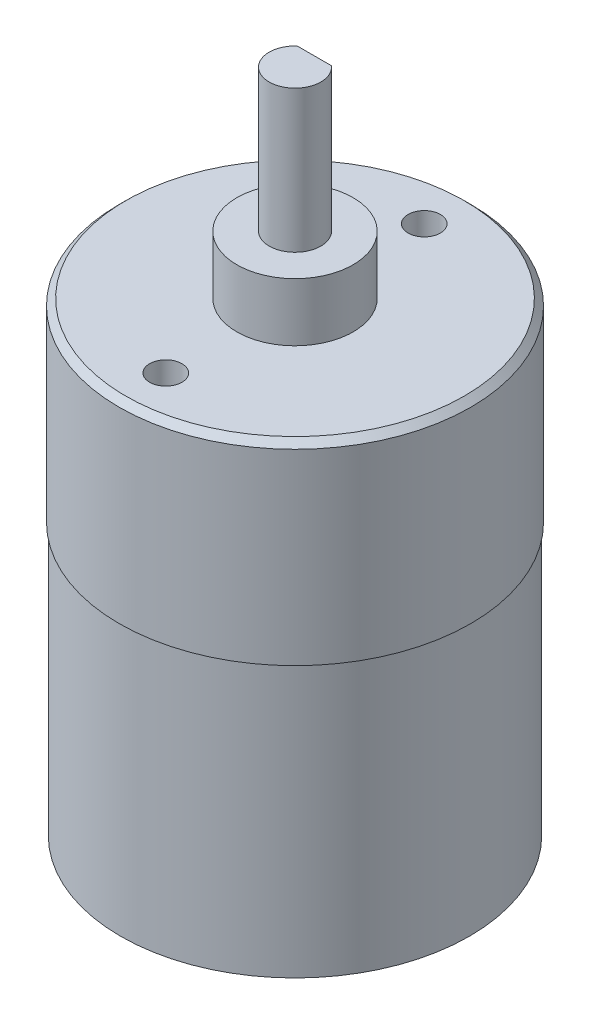
from build123d import *

# Parameters (mm, degrees)
ENL_V_MAT_EXTRU_1_DEPTH = 8.5
ESQUISSE3_R             = 1.25
ENL_V_MAT_EXTRU_2_DEPTH = 4
CHANFREIN1_SIZE         = 0.5


with BuildPart() as part:
    # Esquisse1 → Révolution1 (revolve)
    with BuildSketch(Plane.XY, mode=Mode.PRIVATE) as r_volution1_sk:
        Polygon((4.25, 1), (13.5, 1), (13.5, 22), (13.6, 22), (13.6, 37), (4.5, 37), (4.5, 41.5), (2, 41.5), (2, 52.5), (0, 52.5), (0, 0), (4.25, 0), align=None)
    revolve(r_volution1_sk.sketch.rotate(Axis((0, 52.5, 0), (0, -1, 0)), 180), axis=Axis((0, 52.5, 0), (0, -1, 0)))

    # Esquisse2 → Enlèv. mat.-Extru.1 (cut)
    with BuildSketch(Plane(origin=(0, 52.5, 0), x_dir=(1, 0, 0), z_dir=(0, 1, 0))):
        with BuildLine():
            Line((-1.322875656, 1.5), (1.322875656, 1.5))
            ThreePointArc((1.322875656, 1.5), (0, 2), (-1.322875656, 1.5))
        make_face()
    extrude(amount=-ENL_V_MAT_EXTRU_1_DEPTH, mode=Mode.SUBTRACT)

    # Esquisse3 → Enlèv. mat.-Extru.2 (cut)
    with BuildSketch(Plane(origin=(0, 37, 0), x_dir=(1, 0, 0), z_dir=(0, 1, 0))):
        with Locations(Location((0, 10, 0), (0, 0, 180))):
            Circle(ESQUISSE3_R)
        with Locations((0, -10)):
            Circle(ESQUISSE3_R)
    extrude(amount=-ENL_V_MAT_EXTRU_2_DEPTH, mode=Mode.SUBTRACT)

    # Chanfrein1
    chanfrein1_edges = [part.edges().sort_by_distance(p)[0] for p in [
        (13.6, 37, 0),
    ]]
    chamfer(chanfrein1_edges, length=CHANFREIN1_SIZE)


solid = part.part
